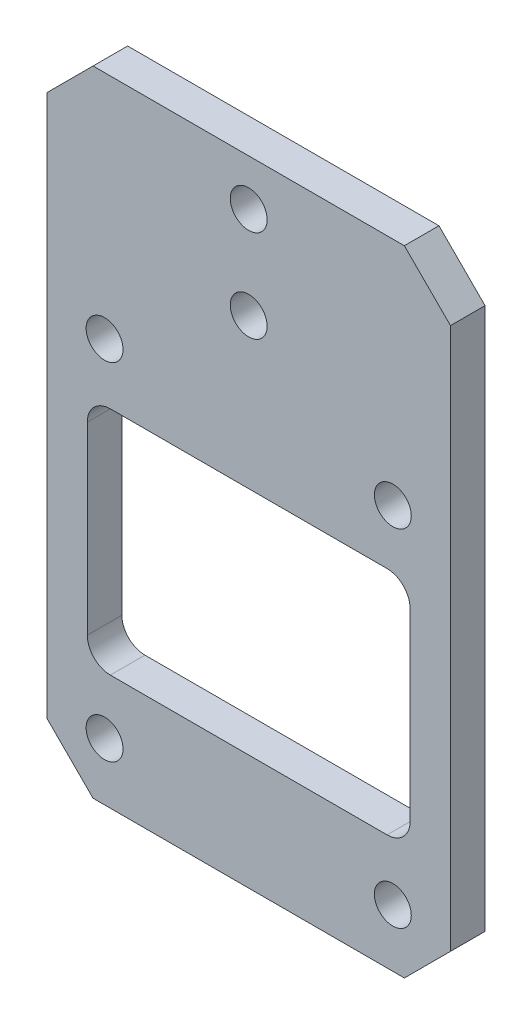
from build123d import *

# Parameters (mm, degrees)
SKETCH_1_W                  = 35
SKETCH_1_H                  = 55
EXTRUDE_1_DEPTH             = 3
CHAMFER_1_SIZE              = 4
SKETCH_2_R                  = 1.6
CUT_EXTRUDE_1_DEPTH         = 33.733774607
PATTERN_LINEAR_1_COUNT      = 2
PATTERN_LINEAR_1_PITCH      = 25
PATTERN_LINEAR_1_COUNT_DIR2 = 2
PATTERN_LINEAR_1_PITCH_DIR2 = 30
SKETCH_3_R                  = 1.6
CUT_EXTRUDE_2_DEPTH         = 33.733774607
PATTERN_LINEAR_2_COUNT      = 2
PATTERN_LINEAR_2_PITCH      = 8
SKETCH_4_W                  = 28
SKETCH_4_H                  = 20
CUT_EXTRUDE_3_DEPTH         = 33.733774607
FILLET_1_R                  = 2


with BuildPart() as part:
    # 草圖1 → 填料-伸長1 (new body)
    with BuildSketch(Plane.XY):
        Rectangle(SKETCH_1_W, SKETCH_1_H)
    extrude(amount=EXTRUDE_1_DEPTH)

    # 導角1
    chamfer_1_edges = [part.edges().sort_by_distance(p)[0] for p in [
        (-17.5, 27.5, 1.5),
        (17.5, 27.5, 1.5),
        (17.5, -27.5, 1.5),
        (-17.5, -27.5, 1.5),
    ]]
    chamfer(chamfer_1_edges, length=CHAMFER_1_SIZE)

    # 草圖2 → 除料-伸長1 (cut, through all)
    with BuildSketch(Plane.XY.offset(3)):
        with Locations((-12.5, 7.5)):
            Circle(SKETCH_2_R)
    cut_extrude_1 = extrude(amount=-CUT_EXTRUDE_1_DEPTH, mode=Mode.SUBTRACT)

    # 直線複製排列1: Cut-Extrude 1 2 × 2
    with Locations(*[(i * PATTERN_LINEAR_1_PITCH, -j * PATTERN_LINEAR_1_PITCH_DIR2, 0) for i in range(PATTERN_LINEAR_1_COUNT) for j in range(PATTERN_LINEAR_1_COUNT_DIR2) if (i, j) != (0, 0)]):
        add(cut_extrude_1, mode=Mode.SUBTRACT)

    # 草圖3 → 除料-伸長2 (cut, through all)
    with BuildSketch(Plane.XY.offset(3)):
        with Locations((0, 23.5)):
            Circle(SKETCH_3_R)
    cut_extrude_2 = extrude(amount=-CUT_EXTRUDE_2_DEPTH, mode=Mode.SUBTRACT)

    # 直線複製排列2: 除料-伸長2 ×2
    with Locations(*[(0, -i * PATTERN_LINEAR_2_PITCH, 0) for i in range(1, PATTERN_LINEAR_2_COUNT)]):
        add(cut_extrude_2, mode=Mode.SUBTRACT)

    # 草圖4 → 除料-伸長3 (cut, through all)
    with BuildSketch(Plane.XY.offset(3)):
        with Locations((0, -7.5)):
            Rectangle(SKETCH_4_W, SKETCH_4_H)
    extrude(amount=-CUT_EXTRUDE_3_DEPTH, mode=Mode.SUBTRACT)

    # 圓角1
    fillet_1_edges = [part.edges().sort_by_distance(p)[0] for p in [
        (-14, -17.5, 1.5),
        (-14, 2.5, 1.5),
        (14, 2.5, 1.5),
        (14, -17.5, 1.5),
    ]]
    fillet(fillet_1_edges, radius=FILLET_1_R)


solid = part.part
